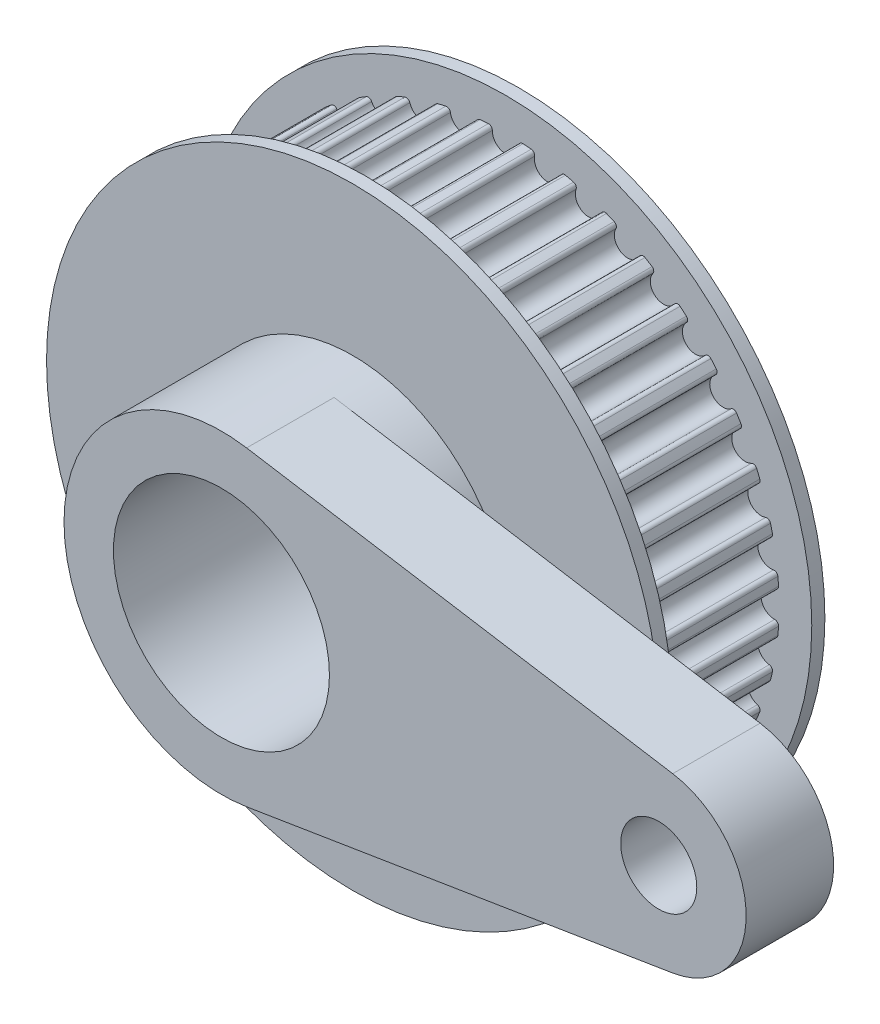
from build123d import *
from build123d.topology import SkipClean

# Parameters (mm, degrees)
BOSS_EXTRUDE1_DEPTH = 15
SKETCH3_R           = 12.35
SKETCH3_R_2         = 4.35
CUT_EXTRUDE1_DEPTH  = 49.969378187
CUT_EXTRUDE2_DEPTH  = 5
SKETCH6_R           = 35
BOSS_EXTRUDE2_DEPTH = 1.5
BOSS_EXTRUDE3_DEPTH = 16
SKETCH8_R           = 35
BOSS_EXTRUDE4_DEPTH = 1.5
SKETCH9_R           = 12.35
CUT_EXTRUDE4_DEPTH  = 78.336925204


with BuildPart() as part:
    # Sketch2 → Boss-Extrude1 (new body)
    with BuildSketch(Plane.XY):
        with BuildLine():
            Line((-22.12, 17.768106258), (26.6, 9.871170143))
            ThreePointArc((26.6, 9.871170143), (35, 0), (26.6, -9.871170143))
            Line((26.6, -9.871170143), (-22.12, -17.768106258))
            ThreePointArc((-22.12, -17.768106258), (-43, 0), (-22.12, 17.768106258))
        make_face()
    extrude(amount=BOSS_EXTRUDE1_DEPTH)

    # Sketch3 → Cut-Extrude1 (cut, through all)
    with BuildSketch(Plane.XY.offset(15)):
        with Locations((-25, 0)):
            Circle(SKETCH3_R)
        with Locations((25, 0)):
            Circle(SKETCH3_R_2)
    extrude(amount=-CUT_EXTRUDE1_DEPTH, mode=Mode.SUBTRACT)

    # Sketch4 → Cut-Extrude2 (cut)
    with SkipClean():  # the faces are left unmerged after this step: merging them gives an invalid solid
        with BuildSketch(Plane(origin=(0, 0, 0), x_dir=(-1, 0, 0), z_dir=(0, 0, -1))):
            with BuildLine():
                Line((22.12, 17.768106258), (-26.6, 9.871170143))
                ThreePointArc((-26.6, 9.871170143), (-35, 0), (-26.6, -9.871170143))
                Line((-26.6, -9.871170143), (22.12, -17.768106258))
                ThreePointArc((22.12, -17.768106258), (7, 0), (22.12, 17.768106258))
            make_face()
        extrude(amount=-CUT_EXTRUDE2_DEPTH, mode=Mode.SUBTRACT)

    # Sketch6 → Boss-Extrude2 (add)
    with SkipClean():  # the faces are left unmerged after this step: merging them gives an invalid solid
        with BuildSketch(Plane(origin=(0, 0, 0), x_dir=(-1, 0, 0), z_dir=(0, 0, -1))):
            with Locations((25, 0)):
                Circle(SKETCH6_R)
        extrude(amount=BOSS_EXTRUDE2_DEPTH)

    # Sketch7 → Boss-Extrude3 (add)
    with SkipClean():  # the faces are left unmerged after this step: merging them gives an invalid solid
        with BuildSketch(Plane(origin=(0, 0, -1.5), x_dir=(-1, 0, 0), z_dir=(0, 0, -1))):
            with BuildLine():
                ThreePointArc((47.827641086, -20.671486704), (46.742620983, -20.200948009), (45.647518011, -20.647518011))
                ThreePointArc((45.647518011, -20.647518011), (45.200948009, -21.742620983), (45.671486704, -22.827641086))
                ThreePointArc((45.671486704, -22.827641086), (45.804096821, -23.147219934), (45.658357236, -23.461028884))
                ThreePointArc((45.658357236, -23.461028884), (45.301745991, -23.770290485), (44.940505624, -24.074132081))
                ThreePointArc((44.940505624, -24.074132081), (44.607761489, -24.168986834), (44.312861979, -23.988016222))
                ThreePointArc((44.312861979, -23.988016222), (43.314808744, -23.353536099), (42.163329367, -23.623296236))
                ThreePointArc((42.163329367, -23.623296236), (41.550945535, -24.635057734), (41.845956579, -25.780327908))
                ThreePointArc((41.845956579, -25.780327908), (41.926940899, -26.116717003), (41.733905075, -26.40386375))
                ThreePointArc((41.733905075, -26.40386375), (41.333305133, -26.653531538), (40.928980937, -26.897121896))
                ThreePointArc((40.928980937, -26.897121896), (40.585494882, -26.938756179), (40.322536115, -26.713881169))
                ThreePointArc((40.322536115, -26.713881169), (39.43602513, -25.931082625), (38.256522592, -26.017390506))
                ThreePointArc((38.256522592, -26.017390506), (37.493403853, -26.920897604), (37.605623095, -28.098217497))
                ThreePointArc((37.605623095, -28.098217497), (37.632987515, -28.443133823), (37.397408635, -28.696547861))
                ThreePointArc((37.397408635, -28.696547861), (36.962684096, -28.880474186), (36.525231875, -29.057815304))
                ThreePointArc((36.525231875, -29.057815304), (36.179461666, -29.045203943), (35.95491856, -28.781961703))
                ThreePointArc((35.95491856, -28.781961703), (35.201778667, -27.870119836), (34.023296236, -27.770850276))
                ThreePointArc((34.023296236, -27.770850276), (33.128233105, -28.543855631), (33.054897334, -29.724235718))
                ThreePointArc((33.054897334, -29.724235718), (33.027968052, -30.069186291), (32.755646849, -30.282627725))
                ThreePointArc((32.755646849, -30.282627725), (32.297502074, -30.396283712), (31.837693353, -30.503008862))
                ThreePointArc((31.837693353, -30.503008862), (31.498153001, -30.43646239), (31.317554552, -30.141334818))
                ThreePointArc((31.317554552, -30.141334818), (30.716330556, -29.122902202), (29.567886379, -28.840499545))
                ThreePointArc((29.567886379, -28.840499545), (28.562918281, -29.463969199), (28.305833268, -30.618344608))
                ThreePointArc((28.305833268, -30.618344608), (28.225273372, -30.954835598), (27.922915298, -31.123048793))
                ThreePointArc((27.922915298, -31.123048793), (27.452631332, -31.163635852), (26.981788128, -31.197117107))
                ThreePointArc((26.981788128, -31.197117107), (26.656838243, -31.07827412), (26.524631384, -30.758528236))
                ThreePointArc((26.524631384, -30.758528236), (26.090127415, -29.658582061), (25, -29.2))
                ThreePointArc((25, -29.2), (23.909872585, -29.658582061), (23.475368616, -30.758528236))
                ThreePointArc((23.475368616, -30.758528236), (23.343161757, -31.07827412), (23.018211872, -31.197117107))
                ThreePointArc((23.018211872, -31.197117107), (22.547368668, -31.163635852), (22.077084702, -31.123048793))
                ThreePointArc((22.077084702, -31.123048793), (21.774726628, -30.954835598), (21.694166732, -30.618344608))
                ThreePointArc((21.694166732, -30.618344608), (21.437081719, -29.463969199), (20.432113621, -28.840499545))
                ThreePointArc((20.432113621, -28.840499545), (19.283669444, -29.122902202), (18.682445448, -30.141334818))
                ThreePointArc((18.682445448, -30.141334818), (18.501846999, -30.43646239), (18.162306647, -30.503008862))
                ThreePointArc((18.162306647, -30.503008862), (17.702497926, -30.396283712), (17.244353151, -30.282627725))
                ThreePointArc((17.244353151, -30.282627725), (16.972031948, -30.069186291), (16.945102666, -29.724235718))
                ThreePointArc((16.945102666, -29.724235718), (16.871766895, -28.543855631), (15.976703764, -27.770850276))
                ThreePointArc((15.976703764, -27.770850276), (14.798221333, -27.870119836), (14.04508144, -28.781961703))
                ThreePointArc((14.04508144, -28.781961703), (13.820538334, -29.045203943), (13.474768125, -29.057815304))
                ThreePointArc((13.474768125, -29.057815304), (13.037315904, -28.880474186), (12.602591365, -28.696547861))
                ThreePointArc((12.602591365, -28.696547861), (12.367012485, -28.443133823), (12.394376905, -28.098217497))
                ThreePointArc((12.394376905, -28.098217497), (12.506596147, -26.920897604), (11.743477408, -26.017390506))
                ThreePointArc((11.743477408, -26.017390506), (10.56397487, -25.931082625), (9.677463885, -26.713881169))
                ThreePointArc((9.677463885, -26.713881169), (9.414505118, -26.938756179), (9.071019063, -26.897121896))
                ThreePointArc((9.071019063, -26.897121896), (8.666694867, -26.653531538), (8.266094925, -26.40386375))
                ThreePointArc((8.266094925, -26.40386375), (8.073059101, -26.116717003), (8.154043421, -25.780327908))
                ThreePointArc((8.154043421, -25.780327908), (8.449054465, -24.635057734), (7.836670633, -23.623296236))
                ThreePointArc((7.836670633, -23.623296236), (6.685191256, -23.353536099), (5.687138021, -23.988016222))
                ThreePointArc((5.687138021, -23.988016222), (5.392238511, -24.168986834), (5.059494376, -24.074132081))
                ThreePointArc((5.059494376, -24.074132081), (4.698254009, -23.770290485), (4.341642764, -23.461028884))
                ThreePointArc((4.341642764, -23.461028884), (4.195903179, -23.147219934), (4.328513296, -22.827641086))
                ThreePointArc((4.328513296, -22.827641086), (4.799051991, -21.742620983), (4.352481989, -20.647518011))
                ThreePointArc((4.352481989, -20.647518011), (3.257379017, -20.200948009), (2.172358914, -20.671486704))
                ThreePointArc((2.172358914, -20.671486704), (1.852780066, -20.804096821), (1.538971116, -20.658357236))
                ThreePointArc((1.538971116, -20.658357236), (1.229709515, -20.301745991), (0.925867919, -19.940505624))
                ThreePointArc((0.925867919, -19.940505624), (0.831013166, -19.607761489), (1.011983778, -19.312861979))
                ThreePointArc((1.011983778, -19.312861979), (1.646463901, -18.314808744), (1.376703764, -17.163329367))
                ThreePointArc((1.376703764, -17.163329367), (0.364942266, -16.550945535), (-0.780327908, -16.845956579))
                ThreePointArc((-0.780327908, -16.845956579), (-1.116717003, -16.926940899), (-1.40386375, -16.733905075))
                ThreePointArc((-1.40386375, -16.733905075), (-1.653531538, -16.333305133), (-1.897121896, -15.928980937))
                ThreePointArc((-1.897121896, -15.928980937), (-1.938756179, -15.585494882), (-1.713881169, -15.322536115))
                ThreePointArc((-1.713881169, -15.322536115), (-0.931082625, -14.43602513), (-1.017390506, -13.256522592))
                ThreePointArc((-1.017390506, -13.256522592), (-1.920897604, -12.493403853), (-3.098217497, -12.605623095))
                ThreePointArc((-3.098217497, -12.605623095), (-3.443133823, -12.632987515), (-3.696547861, -12.397408635))
                ThreePointArc((-3.696547861, -12.397408635), (-3.880474186, -11.962684096), (-4.057815304, -11.525231875))
                ThreePointArc((-4.057815304, -11.525231875), (-4.045203943, -11.179461666), (-3.781961703, -10.95491856))
                ThreePointArc((-3.781961703, -10.95491856), (-2.870119836, -10.201778667), (-2.770850276, -9.023296236))
                ThreePointArc((-2.770850276, -9.023296236), (-3.543855631, -8.128233105), (-4.724235718, -8.054897334))
                ThreePointArc((-4.724235718, -8.054897334), (-5.069186291, -8.027968052), (-5.282627725, -7.755646849))
                ThreePointArc((-5.282627725, -7.755646849), (-5.396283712, -7.297502074), (-5.503008862, -6.837693353))
                ThreePointArc((-5.503008862, -6.837693353), (-5.43646239, -6.498153001), (-5.141334818, -6.317554552))
                ThreePointArc((-5.141334818, -6.317554552), (-4.122902202, -5.716330556), (-3.840499545, -4.567886379))
                ThreePointArc((-3.840499545, -4.567886379), (-4.463969199, -3.562918281), (-5.618344608, -3.305833268))
                ThreePointArc((-5.618344608, -3.305833268), (-5.954835598, -3.225273372), (-6.123048793, -2.922915298))
                ThreePointArc((-6.123048793, -2.922915298), (-6.163635852, -2.452631332), (-6.197117107, -1.981788128))
                ThreePointArc((-6.197117107, -1.981788128), (-6.07827412, -1.656838243), (-5.758528236, -1.524631384))
                ThreePointArc((-5.758528236, -1.524631384), (-4.658582061, -1.090127415), (-4.2, 0))
                ThreePointArc((-4.2, 0), (-4.658582061, 1.090127415), (-5.758528236, 1.524631384))
                ThreePointArc((-5.758528236, 1.524631384), (-6.07827412, 1.656838243), (-6.197117107, 1.981788128))
                ThreePointArc((-6.197117107, 1.981788128), (-6.163635852, 2.452631332), (-6.123048793, 2.922915298))
                ThreePointArc((-6.123048793, 2.922915298), (-5.954835598, 3.225273372), (-5.618344608, 3.305833268))
                ThreePointArc((-5.618344608, 3.305833268), (-4.463969199, 3.562918281), (-3.840499545, 4.567886379))
                ThreePointArc((-3.840499545, 4.567886379), (-4.122902202, 5.716330556), (-5.141334818, 6.317554552))
                ThreePointArc((-5.141334818, 6.317554552), (-5.43646239, 6.498153001), (-5.503008862, 6.837693353))
                ThreePointArc((-5.503008862, 6.837693353), (-5.396283712, 7.297502074), (-5.282627725, 7.755646849))
                ThreePointArc((-5.282627725, 7.755646849), (-5.069186291, 8.027968052), (-4.724235718, 8.054897334))
                ThreePointArc((-4.724235718, 8.054897334), (-3.543855631, 8.128233105), (-2.770850276, 9.023296236))
                ThreePointArc((-2.770850276, 9.023296236), (-2.870119836, 10.201778667), (-3.781961703, 10.95491856))
                ThreePointArc((-3.781961703, 10.95491856), (-4.045203943, 11.179461666), (-4.057815304, 11.525231875))
                ThreePointArc((-4.057815304, 11.525231875), (-3.880474186, 11.962684096), (-3.696547861, 12.397408635))
                ThreePointArc((-3.696547861, 12.397408635), (-3.443133823, 12.632987515), (-3.098217497, 12.605623095))
                ThreePointArc((-3.098217497, 12.605623095), (-1.920897604, 12.493403853), (-1.017390506, 13.256522592))
                ThreePointArc((-1.017390506, 13.256522592), (-0.931082625, 14.43602513), (-1.713881169, 15.322536115))
                ThreePointArc((-1.713881169, 15.322536115), (-1.938756179, 15.585494882), (-1.897121896, 15.928980937))
                ThreePointArc((-1.897121896, 15.928980937), (-1.653531538, 16.333305133), (-1.40386375, 16.733905075))
                ThreePointArc((-1.40386375, 16.733905075), (-1.116717003, 16.926940899), (-0.780327908, 16.845956579))
                ThreePointArc((-0.780327908, 16.845956579), (0.364942266, 16.550945535), (1.376703764, 17.163329367))
                ThreePointArc((1.376703764, 17.163329367), (1.646463901, 18.314808744), (1.011983778, 19.312861979))
                ThreePointArc((1.011983778, 19.312861979), (0.831013166, 19.607761489), (0.925867919, 19.940505624))
                ThreePointArc((0.925867919, 19.940505624), (1.229709515, 20.301745991), (1.538971116, 20.658357236))
                ThreePointArc((1.538971116, 20.658357236), (1.852780066, 20.804096821), (2.172358914, 20.671486704))
                ThreePointArc((2.172358914, 20.671486704), (3.257379017, 20.200948009), (4.352481989, 20.647518011))
                ThreePointArc((4.352481989, 20.647518011), (4.799051991, 21.742620983), (4.328513296, 22.827641086))
                ThreePointArc((4.328513296, 22.827641086), (4.195903179, 23.147219934), (4.341642764, 23.461028884))
                ThreePointArc((4.341642764, 23.461028884), (4.698254009, 23.770290485), (5.059494376, 24.074132081))
                ThreePointArc((5.059494376, 24.074132081), (5.392238511, 24.168986834), (5.687138021, 23.988016222))
                ThreePointArc((5.687138021, 23.988016222), (6.685191256, 23.353536099), (7.836670633, 23.623296236))
                ThreePointArc((7.836670633, 23.623296236), (8.449054465, 24.635057734), (8.154043421, 25.780327908))
                ThreePointArc((8.154043421, 25.780327908), (8.073059101, 26.116717003), (8.266094925, 26.40386375))
                ThreePointArc((8.266094925, 26.40386375), (8.666694867, 26.653531538), (9.071019063, 26.897121896))
                ThreePointArc((9.071019063, 26.897121896), (9.414505118, 26.938756179), (9.677463885, 26.713881169))
                ThreePointArc((9.677463885, 26.713881169), (10.56397487, 25.931082625), (11.743477408, 26.017390506))
                ThreePointArc((11.743477408, 26.017390506), (12.506596147, 26.920897604), (12.394376905, 28.098217497))
                ThreePointArc((12.394376905, 28.098217497), (12.367012485, 28.443133823), (12.602591365, 28.696547861))
                ThreePointArc((12.602591365, 28.696547861), (13.037315904, 28.880474186), (13.474768125, 29.057815304))
                ThreePointArc((13.474768125, 29.057815304), (13.820538334, 29.045203943), (14.04508144, 28.781961703))
                ThreePointArc((14.04508144, 28.781961703), (14.798221333, 27.870119836), (15.976703764, 27.770850276))
                ThreePointArc((15.976703764, 27.770850276), (16.871766895, 28.543855631), (16.945102666, 29.724235718))
                ThreePointArc((16.945102666, 29.724235718), (16.972031948, 30.069186291), (17.244353151, 30.282627725))
                ThreePointArc((17.244353151, 30.282627725), (17.702497926, 30.396283712), (18.162306647, 30.503008862))
                ThreePointArc((18.162306647, 30.503008862), (18.501846999, 30.43646239), (18.682445448, 30.141334818))
                ThreePointArc((18.682445448, 30.141334818), (19.283669444, 29.122902202), (20.432113621, 28.840499545))
                ThreePointArc((20.432113621, 28.840499545), (21.437081719, 29.463969199), (21.694166732, 30.618344608))
                ThreePointArc((21.694166732, 30.618344608), (21.774726628, 30.954835598), (22.077084702, 31.123048793))
                ThreePointArc((22.077084702, 31.123048793), (22.547368668, 31.163635852), (23.018211872, 31.197117107))
                ThreePointArc((23.018211872, 31.197117107), (23.343161757, 31.07827412), (23.475368616, 30.758528236))
                ThreePointArc((23.475368616, 30.758528236), (23.909872585, 29.658582061), (25, 29.2))
                ThreePointArc((25, 29.2), (26.090127415, 29.658582061), (26.524631384, 30.758528236))
                ThreePointArc((26.524631384, 30.758528236), (26.656838243, 31.07827412), (26.981788128, 31.197117107))
                ThreePointArc((26.981788128, 31.197117107), (27.452631332, 31.163635852), (27.922915298, 31.123048793))
                ThreePointArc((27.922915298, 31.123048793), (28.225273372, 30.954835598), (28.305833268, 30.618344608))
                ThreePointArc((28.305833268, 30.618344608), (28.562918281, 29.463969199), (29.567886379, 28.840499545))
                ThreePointArc((29.567886379, 28.840499545), (30.716330556, 29.122902202), (31.317554552, 30.141334818))
                ThreePointArc((31.317554552, 30.141334818), (31.498153001, 30.43646239), (31.837693353, 30.503008862))
                ThreePointArc((31.837693353, 30.503008862), (32.297502074, 30.396283712), (32.755646849, 30.282627725))
                ThreePointArc((32.755646849, 30.282627725), (33.027968052, 30.069186291), (33.054897334, 29.724235718))
                ThreePointArc((33.054897334, 29.724235718), (33.128233105, 28.543855631), (34.023296236, 27.770850276))
                ThreePointArc((34.023296236, 27.770850276), (35.201778667, 27.870119836), (35.95491856, 28.781961703))
                ThreePointArc((35.95491856, 28.781961703), (36.179461666, 29.045203943), (36.525231875, 29.057815304))
                ThreePointArc((36.525231875, 29.057815304), (36.962684096, 28.880474186), (37.397408635, 28.696547861))
                ThreePointArc((37.397408635, 28.696547861), (37.632987515, 28.443133823), (37.605623095, 28.098217497))
                ThreePointArc((37.605623095, 28.098217497), (37.493403853, 26.920897604), (38.256522592, 26.017390506))
                ThreePointArc((38.256522592, 26.017390506), (39.43602513, 25.931082625), (40.322536115, 26.713881169))
                ThreePointArc((40.322536115, 26.713881169), (40.585494882, 26.938756179), (40.928980937, 26.897121896))
                ThreePointArc((40.928980937, 26.897121896), (41.333305133, 26.653531538), (41.733905075, 26.40386375))
                ThreePointArc((41.733905075, 26.40386375), (41.926940899, 26.116717003), (41.845956579, 25.780327908))
                ThreePointArc((41.845956579, 25.780327908), (41.550945535, 24.635057734), (42.163329367, 23.623296236))
                ThreePointArc((42.163329367, 23.623296236), (43.314808744, 23.353536099), (44.312861979, 23.988016222))
                ThreePointArc((44.312861979, 23.988016222), (44.607761489, 24.168986834), (44.940505624, 24.074132081))
                ThreePointArc((44.940505624, 24.074132081), (45.301745991, 23.770290485), (45.658357236, 23.461028884))
                ThreePointArc((45.658357236, 23.461028884), (45.804096821, 23.147219934), (45.671486704, 22.827641086))
                ThreePointArc((45.671486704, 22.827641086), (45.200948009, 21.742620983), (45.647518011, 20.647518011))
                ThreePointArc((45.647518011, 20.647518011), (46.742620983, 20.200948009), (47.827641086, 20.671486704))
                ThreePointArc((47.827641086, 20.671486704), (48.147219934, 20.804096821), (48.461028884, 20.658357236))
                ThreePointArc((48.461028884, 20.658357236), (48.770290485, 20.301745991), (49.074132081, 19.940505624))
                ThreePointArc((49.074132081, 19.940505624), (49.168986834, 19.607761489), (48.988016222, 19.312861979))
                ThreePointArc((48.988016222, 19.312861979), (48.353536099, 18.314808744), (48.623296236, 17.163329367))
                ThreePointArc((48.623296236, 17.163329367), (49.635057734, 16.550945535), (50.780327908, 16.845956579))
                ThreePointArc((50.780327908, 16.845956579), (51.116717003, 16.926940899), (51.40386375, 16.733905075))
                ThreePointArc((51.40386375, 16.733905075), (51.653531538, 16.333305133), (51.897121896, 15.928980937))
                ThreePointArc((51.897121896, 15.928980937), (51.938756179, 15.585494882), (51.713881169, 15.322536115))
                ThreePointArc((51.713881169, 15.322536115), (50.931082625, 14.43602513), (51.017390506, 13.256522592))
                ThreePointArc((51.017390506, 13.256522592), (51.920897604, 12.493403853), (53.098217497, 12.605623095))
                ThreePointArc((53.098217497, 12.605623095), (53.443133823, 12.632987515), (53.696547861, 12.397408635))
                ThreePointArc((53.696547861, 12.397408635), (53.880474186, 11.962684096), (54.057815304, 11.525231875))
                ThreePointArc((54.057815304, 11.525231875), (54.045203943, 11.179461666), (53.781961703, 10.95491856))
                ThreePointArc((53.781961703, 10.95491856), (52.870119836, 10.201778667), (52.770850276, 9.023296236))
                ThreePointArc((52.770850276, 9.023296236), (53.543855631, 8.128233105), (54.724235718, 8.054897334))
                ThreePointArc((54.724235718, 8.054897334), (55.069186291, 8.027968052), (55.282627725, 7.755646849))
                ThreePointArc((55.282627725, 7.755646849), (55.396283712, 7.297502074), (55.503008862, 6.837693353))
                ThreePointArc((55.503008862, 6.837693353), (55.43646239, 6.498153001), (55.141334818, 6.317554552))
                ThreePointArc((55.141334818, 6.317554552), (54.122902202, 5.716330556), (53.840499545, 4.567886379))
                ThreePointArc((53.840499545, 4.567886379), (54.463969199, 3.562918281), (55.618344608, 3.305833268))
                ThreePointArc((55.618344608, 3.305833268), (55.954835598, 3.225273372), (56.123048793, 2.922915298))
                ThreePointArc((56.123048793, 2.922915298), (56.163635852, 2.452631332), (56.197117107, 1.981788128))
                ThreePointArc((56.197117107, 1.981788128), (56.07827412, 1.656838243), (55.758528236, 1.524631384))
                ThreePointArc((55.758528236, 1.524631384), (54.658582061, 1.090127415), (54.2, 0))
                ThreePointArc((54.2, 0), (54.658582061, -1.090127415), (55.758528236, -1.524631384))
                ThreePointArc((55.758528236, -1.524631384), (56.07827412, -1.656838243), (56.197117107, -1.981788128))
                ThreePointArc((56.197117107, -1.981788128), (56.163635852, -2.452631332), (56.123048793, -2.922915298))
                ThreePointArc((56.123048793, -2.922915298), (55.954835598, -3.225273372), (55.618344608, -3.305833268))
                ThreePointArc((55.618344608, -3.305833268), (54.463969199, -3.562918281), (53.840499545, -4.567886379))
                ThreePointArc((53.840499545, -4.567886379), (54.122902202, -5.716330556), (55.141334818, -6.317554552))
                ThreePointArc((55.141334818, -6.317554552), (55.43646239, -6.498153001), (55.503008862, -6.837693353))
                ThreePointArc((55.503008862, -6.837693353), (55.396283712, -7.297502074), (55.282627725, -7.755646849))
                ThreePointArc((55.282627725, -7.755646849), (55.069186291, -8.027968052), (54.724235718, -8.054897334))
                ThreePointArc((54.724235718, -8.054897334), (53.543855631, -8.128233105), (52.770850276, -9.023296236))
                ThreePointArc((52.770850276, -9.023296236), (52.870119836, -10.201778667), (53.781961703, -10.95491856))
                ThreePointArc((53.781961703, -10.95491856), (54.045203943, -11.179461666), (54.057815304, -11.525231875))
                ThreePointArc((54.057815304, -11.525231875), (53.880474186, -11.962684096), (53.696547861, -12.397408635))
                ThreePointArc((53.696547861, -12.397408635), (53.443133823, -12.632987515), (53.098217497, -12.605623095))
                ThreePointArc((53.098217497, -12.605623095), (51.920897604, -12.493403853), (51.017390506, -13.256522592))
                ThreePointArc((51.017390506, -13.256522592), (50.931082625, -14.43602513), (51.713881169, -15.322536115))
                ThreePointArc((51.713881169, -15.322536115), (51.938756179, -15.585494882), (51.897121896, -15.928980937))
                ThreePointArc((51.897121896, -15.928980937), (51.653531538, -16.333305133), (51.40386375, -16.733905075))
                ThreePointArc((51.40386375, -16.733905075), (51.116717003, -16.926940899), (50.780327908, -16.845956579))
                ThreePointArc((50.780327908, -16.845956579), (49.635057734, -16.550945535), (48.623296236, -17.163329367))
                ThreePointArc((48.623296236, -17.163329367), (48.353536099, -18.314808744), (48.988016222, -19.312861979))
                ThreePointArc((48.988016222, -19.312861979), (49.168986834, -19.607761489), (49.074132081, -19.940505624))
                ThreePointArc((49.074132081, -19.940505624), (48.770290485, -20.301745991), (48.461028884, -20.658357236))
                ThreePointArc((48.461028884, -20.658357236), (48.147219934, -20.804096821), (47.827641086, -20.671486704))
            make_face()
        extrude(amount=BOSS_EXTRUDE3_DEPTH)

    # Sketch8 → Boss-Extrude4 (add)
    with SkipClean():  # the faces are left unmerged after this step: merging them gives an invalid solid
        with BuildSketch(Plane(origin=(0, 0, -17.5), x_dir=(-1, 0, 0), z_dir=(0, 0, -1))):
            with Locations((25, 0)):
                Circle(SKETCH8_R)
        extrude(amount=BOSS_EXTRUDE4_DEPTH)

    # Sketch9 → Cut-Extrude4 (cut, through all)
    with SkipClean():  # the faces are left unmerged after this step: merging them gives an invalid solid
        with BuildSketch(Plane(origin=(0, 0, -19), x_dir=(-1, 0, 0), z_dir=(0, 0, -1))):
            with Locations(Location((25, 0, 0), (0, 0, 180))):
                Circle(SKETCH9_R)
        extrude(amount=-CUT_EXTRUDE4_DEPTH, mode=Mode.SUBTRACT)


solid = part.part
